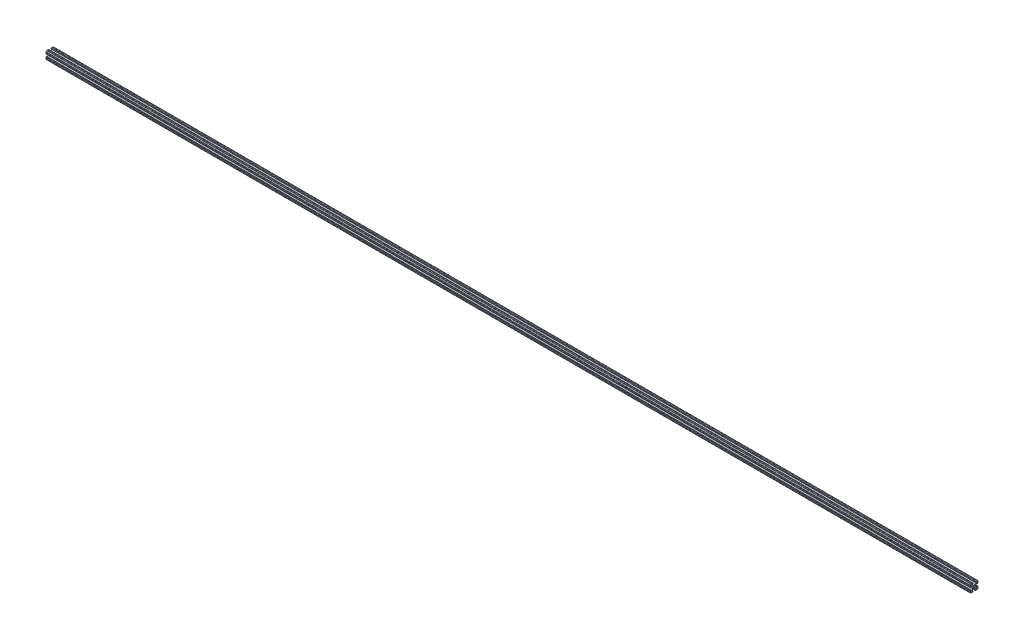
from build123d import *

# Parameters (mm, degrees)
SKETCH1_R           = 2.6035
BOSS_EXTRUDE1_DEPTH = 1524


with BuildPart() as part:
    # Sketch1 → Boss-Extrude1 (new, symmetric)
    with BuildSketch(Plane(origin=(0, 0, 0), x_dir=(0, 0, -1), z_dir=(1, 0, 0))):
        with BuildLine():
            Line((6.333126718, -12.7), (9.550443118, -12.7))
            ThreePointArc((9.550443118, -12.7), (10.058366869, -12.192000006), (10.566443095, -12.699847501))
            ThreePointArc((10.566443095, -12.699847501), (12.082537762, -12.08250727), (12.699846982, -10.566399977))
            ThreePointArc((12.699846982, -10.566399977), (12.192000006, -10.058323491), (12.7, -9.5504))
            Line((12.7, -9.5504), (12.7, -6.3330836))
            ThreePointArc((12.7, -6.3330836), (12.192, -5.8250836), (12.7, -5.3170836))
            Line((12.7, -5.3170836), (12.7, -4.287469289))
            ThreePointArc((12.7, -4.287469289), (12.39275138, -3.545705502), (11.650987593, -3.238456882))
            Line((11.650987593, -3.238456882), (11.539212407, -3.238456882))
            ThreePointArc((11.539212407, -3.238456882), (10.79744862, -3.545705502), (10.4902, -4.287469289))
            Line((10.4902, -4.287469289), (10.4902, -6.402089023))
            ThreePointArc((10.4902, -6.402089023), (9.856505071, -7.351067942), (8.737131347, -7.129408934))
            Line((8.737131347, -7.129408934), (5.441005833, -3.840816462))
            ThreePointArc((5.441005833, -3.840816462), (4.750877967, -2.809883091), (4.5085, -1.593185507))
            Line((4.5085, -1.593185507), (4.5085, 1.593185507))
            ThreePointArc((4.5085, 1.593185507), (4.750877967, 2.809883091), (5.441005833, 3.840816462))
            Line((5.441005833, 3.840816462), (8.737131347, 7.129408934))
            ThreePointArc((8.737131347, 7.129408934), (9.856505071, 7.351067942), (10.4902, 6.402089023))
            Line((10.4902, 6.402089023), (10.4902, 4.287469289))
            ThreePointArc((10.4902, 4.287469289), (10.79744862, 3.545705502), (11.539212407, 3.238456882))
            Line((11.539212407, 3.238456882), (11.650987593, 3.238456882))
            ThreePointArc((11.650987593, 3.238456882), (12.39275138, 3.545705502), (12.7, 4.287469289))
            Line((12.7, 4.287469289), (12.7, 5.3170836))
            ThreePointArc((12.7, 5.3170836), (12.192, 5.8250836), (12.7, 6.3330836))
            Line((12.7, 6.3330836), (12.7, 9.5504))
            ThreePointArc((12.7, 9.5504), (12.192000006, 10.058323491), (12.699846982, 10.566399977))
            ThreePointArc((12.699846982, 10.566399977), (12.082537762, 12.08250727), (10.566443095, 12.699847501))
            ThreePointArc((10.566443095, 12.699847501), (10.058366869, 12.192000006), (9.550443118, 12.7))
            Line((9.550443118, 12.7), (6.333126718, 12.7))
            ThreePointArc((6.333126718, 12.7), (5.825126718, 12.192), (5.317126718, 12.7))
            Line((5.317126718, 12.7), (4.287512407, 12.7))
            ThreePointArc((4.287512407, 12.7), (3.54574862, 12.39275138), (3.2385, 11.650987593))
            Line((3.2385, 11.650987593), (3.2385, 11.539212407))
            ThreePointArc((3.2385, 11.539212407), (3.54574862, 10.79744862), (4.287512407, 10.4902))
            Line((4.287512407, 10.4902), (6.476788598, 10.4902))
            ThreePointArc((6.476788598, 10.4902), (7.432222385, 9.85140422), (7.207036008, 8.724370562))
            Line((7.207036008, 8.724370562), (3.898272566, 5.423169045))
            ThreePointArc((3.898272566, 5.423169045), (2.869120213, 4.736787962), (1.655778399, 4.4958))
            Line((1.655778399, 4.4958), (-1.655778399, 4.4958))
            ThreePointArc((-1.655778399, 4.4958), (-2.869120213, 4.736787962), (-3.898272566, 5.423169045))
            Line((-3.898272566, 5.423169045), (-7.207036008, 8.724370562))
            ThreePointArc((-7.207036008, 8.724370562), (-7.432222385, 9.85140422), (-6.476788598, 10.4902))
            Line((-6.476788598, 10.4902), (-4.287512407, 10.4902))
            ThreePointArc((-4.287512407, 10.4902), (-3.54574862, 10.79744862), (-3.2385, 11.539212407))
            Line((-3.2385, 11.539212407), (-3.2385, 11.650987593))
            ThreePointArc((-3.2385, 11.650987593), (-3.54574862, 12.39275138), (-4.287512407, 12.7))
            Line((-4.287512407, 12.7), (-5.317126718, 12.7))
            ThreePointArc((-5.317126718, 12.7), (-5.825126718, 12.192), (-6.333126718, 12.7))
            Line((-6.333126718, 12.7), (-9.550443118, 12.7))
            ThreePointArc((-9.550443118, 12.7), (-10.058366869, 12.192000006), (-10.566443095, 12.699847501))
            ThreePointArc((-10.566443095, 12.699847501), (-12.082537762, 12.08250727), (-12.699846982, 10.566399977))
            ThreePointArc((-12.699846982, 10.566399977), (-12.192000006, 10.058323491), (-12.7, 9.5504))
            Line((-12.7, 9.5504), (-12.7, 6.3330836))
            ThreePointArc((-12.7, 6.3330836), (-12.192, 5.8250836), (-12.7, 5.3170836))
            Line((-12.7, 5.3170836), (-12.7, 4.287469289))
            ThreePointArc((-12.7, 4.287469289), (-12.39275138, 3.545705502), (-11.650987593, 3.238456882))
            Line((-11.650987593, 3.238456882), (-11.539212407, 3.238456882))
            ThreePointArc((-11.539212407, 3.238456882), (-10.79744862, 3.545705502), (-10.4902, 4.287469289))
            Line((-10.4902, 4.287469289), (-10.4902, 6.402089023))
            ThreePointArc((-10.4902, 6.402089023), (-9.856505071, 7.351067942), (-8.737131347, 7.129408934))
            Line((-8.737131347, 7.129408934), (-5.441005833, 3.840816462))
            ThreePointArc((-5.441005833, 3.840816462), (-4.750877967, 2.809883091), (-4.5085, 1.593185507))
            Line((-4.5085, 1.593185507), (-4.5085, -1.593185507))
            ThreePointArc((-4.5085, -1.593185507), (-4.750877967, -2.809883091), (-5.441005833, -3.840816462))
            Line((-5.441005833, -3.840816462), (-8.737131347, -7.129408934))
            ThreePointArc((-8.737131347, -7.129408934), (-9.856505071, -7.351067942), (-10.4902, -6.402089023))
            Line((-10.4902, -6.402089023), (-10.4902, -4.287469289))
            ThreePointArc((-10.4902, -4.287469289), (-10.79744862, -3.545705502), (-11.539212407, -3.238456882))
            Line((-11.539212407, -3.238456882), (-11.650987593, -3.238456882))
            ThreePointArc((-11.650987593, -3.238456882), (-12.39275138, -3.545705502), (-12.7, -4.287469289))
            Line((-12.7, -4.287469289), (-12.7, -5.3170836))
            ThreePointArc((-12.7, -5.3170836), (-12.192, -5.8250836), (-12.7, -6.3330836))
            Line((-12.7, -6.3330836), (-12.7, -9.5504))
            ThreePointArc((-12.7, -9.5504), (-12.192000006, -10.058323491), (-12.699846982, -10.566399977))
            ThreePointArc((-12.699846982, -10.566399977), (-12.082537762, -12.08250727), (-10.566443095, -12.699847501))
            ThreePointArc((-10.566443095, -12.699847501), (-10.058366869, -12.192000006), (-9.550443118, -12.7))
            Line((-9.550443118, -12.7), (-6.333126718, -12.7))
            ThreePointArc((-6.333126718, -12.7), (-5.825126718, -12.192), (-5.317126718, -12.7))
            Line((-5.317126718, -12.7), (-4.287512407, -12.7))
            ThreePointArc((-4.287512407, -12.7), (-3.54574862, -12.39275138), (-3.2385, -11.650987593))
            Line((-3.2385, -11.650987593), (-3.2385, -11.539212407))
            ThreePointArc((-3.2385, -11.539212407), (-3.54574862, -10.79744862), (-4.287512407, -10.4902))
            Line((-4.287512407, -10.4902), (-6.416408329, -10.4902))
            ThreePointArc((-6.416408329, -10.4902), (-7.41473083, -9.822813117), (-7.179650497, -8.645192506))
            Line((-7.179650497, -8.645192506), (-3.952270251, -5.423690499))
            ThreePointArc((-3.952270251, -5.423690499), (-2.922936451, -4.736929036), (-1.709253557, -4.4958))
            Line((-1.709253557, -4.4958), (1.709253557, -4.4958))
            ThreePointArc((1.709253557, -4.4958), (2.922936451, -4.736929036), (3.952270251, -5.423690499))
            Line((3.952270251, -5.423690499), (7.179650497, -8.645192506))
            ThreePointArc((7.179650497, -8.645192506), (7.41473083, -9.822813117), (6.416408329, -10.4902))
            Line((6.416408329, -10.4902), (4.287512407, -10.4902))
            ThreePointArc((4.287512407, -10.4902), (3.54574862, -10.79744862), (3.2385, -11.539212407))
            Line((3.2385, -11.539212407), (3.2385, -11.650987593))
            ThreePointArc((3.2385, -11.650987593), (3.54574862, -12.39275138), (4.287512407, -12.7))
            Line((4.287512407, -12.7), (5.317126718, -12.7))
            ThreePointArc((5.317126718, -12.7), (5.825126718, -12.192), (6.333126718, -12.7))
        make_face()
        Circle(SKETCH1_R, mode=Mode.SUBTRACT)
    extrude(amount=BOSS_EXTRUDE1_DEPTH, both=True)


solid = part.part
